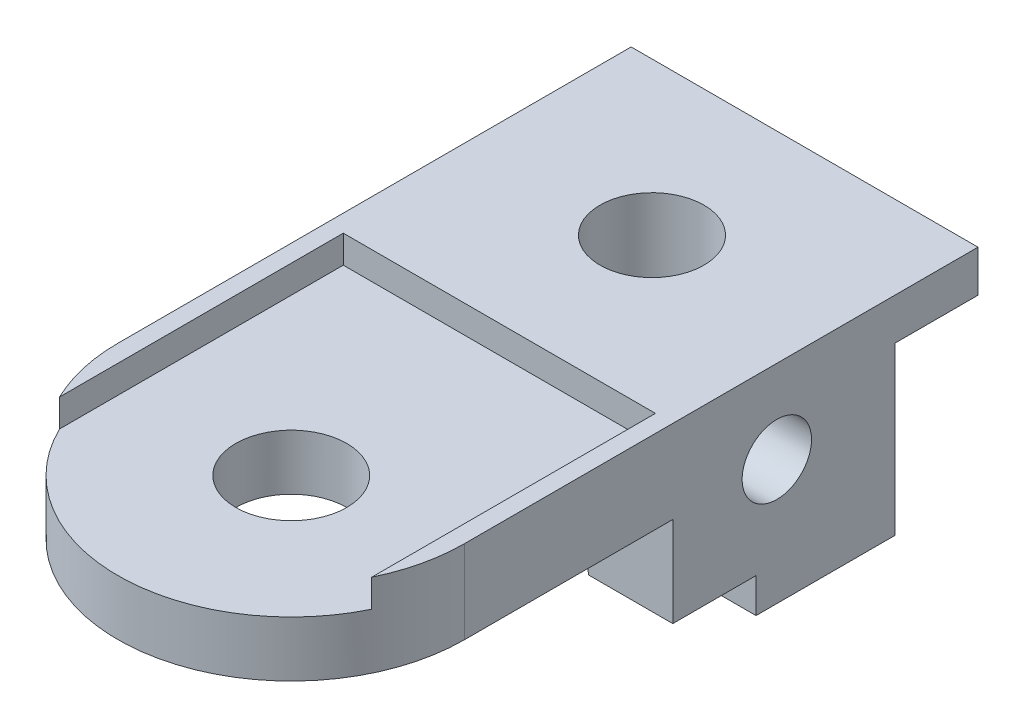
from build123d import *

# Parameters (mm, degrees)
BOSS_EXTRU_1_DEPTH      = 12
ENL_V_MAT_EXTRU_1_DEPTH = 4
ESQUISSE3_R             = 8
ENL_V_MAT_EXTRU_2_DEPTH = 41.853396432
ESQUISSE4_W             = 50
ESQUISSE4_H             = 12
BOSS_EXTRU_2_DEPTH      = 25
ENL_V_MAT_EXTRU_3_DEPTH = 66.383484153
ESQUISSE7_W             = 50
ESQUISSE7_H             = 20
BOSS_EXTRU_3_DEPTH      = 30
ESQUISSE9_W             = 50
ESQUISSE9_H             = 12
BOSS_EXTRU_4_DEPTH      = 6
ESQUISSE10_R            = 5
ENL_V_MAT_EXTRU_4_DEPTH = 95.212525707
ESQUISSE11_R            = 7.5
ENL_V_MAT_EXTRU_5_DEPTH = 84.671978613


with BuildPart() as part:
    # Esquisse1 → Boss.-Extru.1 (new body)
    with BuildSketch(Plane(origin=(0, 0, 0), x_dir=(1, 0, 0), z_dir=(0, 1, 0))):
        with BuildLine():
            Line((-25, 0), (-25, 30))
            Line((-25, 30), (25, 30))
            Line((25, 30), (25, 0))
            ThreePointArc((25, 0), (0, -25), (-25, 0))
        make_face()
    extrude(amount=-BOSS_EXTRU_1_DEPTH)

    # Esquisse2 → Enlèv. mat.-Extru.1 (cut)
    with BuildSketch(Plane(origin=(0, 0, 0), x_dir=(1, 0, 0), z_dir=(0, 1, 0))):
        with BuildLine():
            Line((-22.5, 30), (22.5, 30))
            Line((22.5, 30), (22.5, -10.897247359))
            ThreePointArc((22.5, -10.897247359), (0, -25), (-22.5, -10.897247359))
            Line((-22.5, -10.897247359), (-22.5, 30))
        make_face()
    extrude(amount=-ENL_V_MAT_EXTRU_1_DEPTH, mode=Mode.SUBTRACT)

    # Esquisse3 → Enlèv. mat.-Extru.2 (cut, through all)
    with BuildSketch(Plane.XZ.offset(12)):
        with Locations(Location((0, 0, 0), (0, 0, 270))):
            Circle(ESQUISSE3_R)
    extrude(amount=-ENL_V_MAT_EXTRU_2_DEPTH, mode=Mode.SUBTRACT)

    # Esquisse4 → Boss.-Extru.2 (add)
    with BuildSketch(Plane(origin=(0, 0, 0), x_dir=(1, 0, 0), z_dir=(0, 1, 0))):
        with Locations((0, 36)):
            Rectangle(ESQUISSE4_W, ESQUISSE4_H)
    extrude(amount=-BOSS_EXTRU_2_DEPTH)

    # Esquisse5 → Enlèv. mat.-Extru.3 (cut, through all)
    with BuildSketch(Plane.XY.offset(-30)):
        with BuildLine():
            Line((12.834819399, -25), (-12.834819399, -25))
            ThreePointArc((-12.834819399, -25), (0, -12.165180601), (12.834819399, -25))
        make_face()
    extrude(amount=-ENL_V_MAT_EXTRU_3_DEPTH, mode=Mode.SUBTRACT)

    # Esquisse7 → Boss.-Extru.3 (add)
    with BuildSketch(Plane(origin=(0, 0, 0), x_dir=(1, 0, 0), z_dir=(0, 1, 0))):
        with Locations((0, 52)):
            Rectangle(ESQUISSE7_W, ESQUISSE7_H)
    extrude(amount=-BOSS_EXTRU_3_DEPTH)

    # Esquisse9 → Boss.-Extru.4 (add)
    with BuildSketch(Plane(origin=(0, 0, 0), x_dir=(1, 0, 0), z_dir=(0, 1, 0))):
        with Locations((0, 68)):
            Rectangle(ESQUISSE9_W, ESQUISSE9_H)
    extrude(amount=-BOSS_EXTRU_4_DEPTH)

    # Esquisse10 → Enlèv. mat.-Extru.4 (cut, through all)
    with BuildSketch(Plane(origin=(25, 0, 0), x_dir=(0, 0, -1), z_dir=(1, 0, 0))):
        with Locations((45, -12)):
            Circle(ESQUISSE10_R)
    extrude(amount=-ENL_V_MAT_EXTRU_4_DEPTH, mode=Mode.SUBTRACT)

    # Esquisse11 → Enlèv. mat.-Extru.5 (cut, through all)
    with BuildSketch(Plane.XZ.offset(30)):
        with Locations(Location((0, -52, 0), (0, 0, 270))):
            Circle(ESQUISSE11_R)
    extrude(amount=-ENL_V_MAT_EXTRU_5_DEPTH, mode=Mode.SUBTRACT)


solid = part.part
